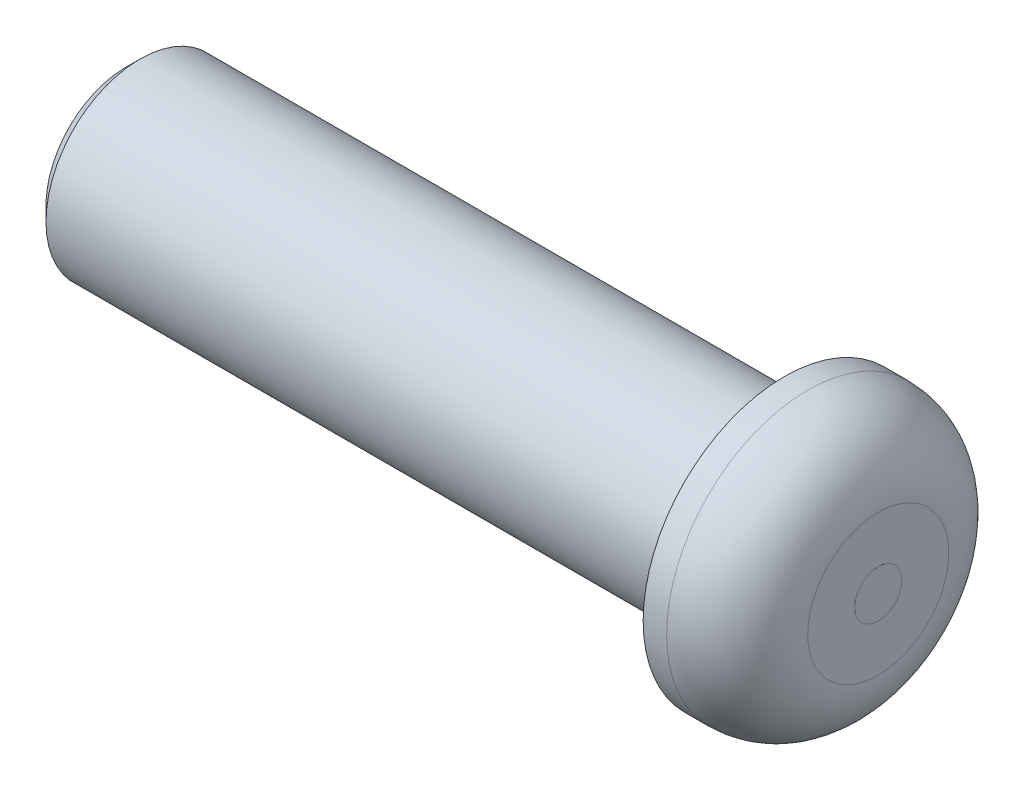
from build123d import *

# Parameters (mm, degrees)
FILETE1_R     = 1.5
CHANFRO1_SIZE = 0.3


with BuildPart() as part:
    # Esboço1 → Revolução1 (revolve)
    with BuildSketch(Plane.XY, mode=Mode.PRIVATE) as revolu_o1_sk:
        Polygon((0, 0), (16.000553077, 0), (16, 0.5), (16, 3), (14, 3), (14, 2), (0, 2), align=None)
    revolve(revolu_o1_sk.sketch.rotate(Axis((0, 0, 0), (1, 0, 0)), 90), axis=Axis((0, 0, 0), (1, 0, 0)))

    # Filete1
    filete1_edges = [part.edges().sort_by_distance(p)[0] for p in [
        (16, 0, -3),
    ]]
    fillet(filete1_edges, radius=FILETE1_R)

    # Chanfro1
    chanfro1_edges = [part.edges().sort_by_distance(p)[0] for p in [
        (0, 0, -2),
    ]]
    chamfer(chanfro1_edges, length=CHANFRO1_SIZE)


solid = part.part
